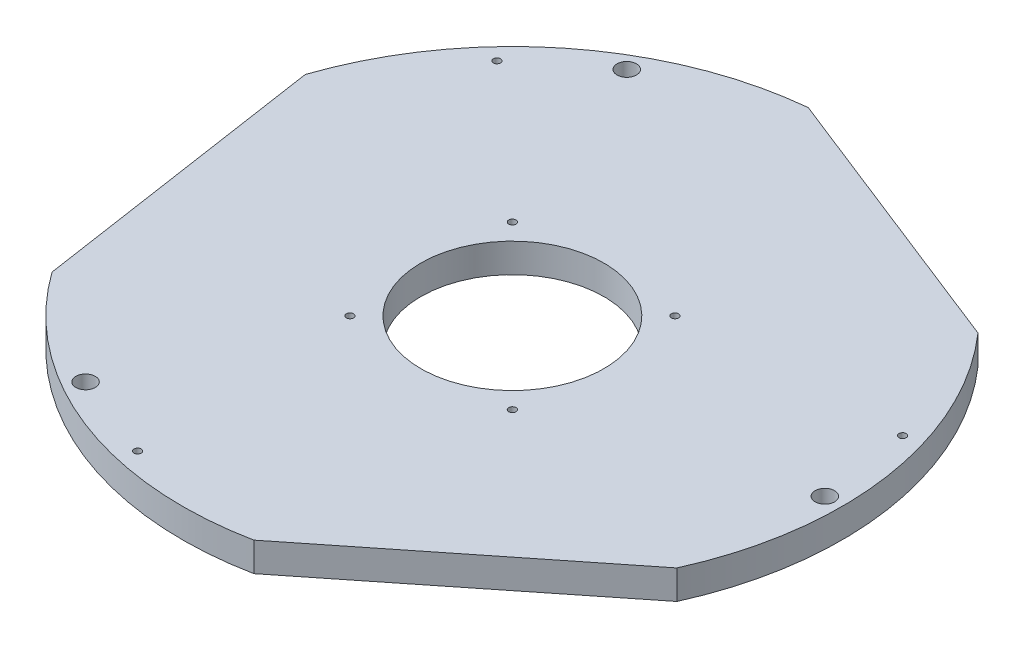
from build123d import *

# Parameters (mm, degrees)
SKETCH1_W                    = 144.145
SKETCH1_H                    = 12.7
F_1_8_0_125_DIAMETER_HOLE1_D = 3.175
SKETCH4_OUTSIDE_W            = 371.87
SKETCH4_OUTSIDE_H            = 371.87
CUT_EXTRUDE1_DEPTH           = 205.247036821
SKETCH6_R                    = 40
CUT_EXTRUDE2_DEPTH           = 205.247036821
M10X1_5_TAPPED_HOLE1_D       = 8.5


with BuildPart() as part:
    # Sketch1 → Revolve1 (revolve)
    with BuildSketch(Plane.XY):
        with Locations((72.0725, -28.730222222)):
            Rectangle(SKETCH1_W, SKETCH1_H)
    revolve(axis=Axis((1e-09, -200000, 0), (0, 1, 0)))

    # 1/8 (0.125) Diameter Hole1 (through all)
    with Locations(Plane(origin=(0, -22.380222222, 0), x_dir=(1, 0, 0), z_dir=(0, 1, 0))):
        with Locations((136.525, 0), (-68.2625, -118.234118252), (-68.2625, 118.234118252), (-99.848064114, 93.109826108), (130.559506808, 39.916046987), (-30.711442694, -133.025873095), (-35.5, -35.5), (-35.5, 35.5), (35.5, 35.5), (35.5, -35.5)):
            Hole(F_1_8_0_125_DIAMETER_HOLE1_D / 2)

    # Sketch4 outside → Cut-Extrude1 (cut, through all)
    with BuildSketch(Plane(origin=(0, -22.380222222, 0), x_dir=(1, 0, 0), z_dir=(0, 1, 0))):
        Rectangle(SKETCH4_OUTSIDE_W, SKETCH4_OUTSIDE_H)
        Polygon((253.722129587, 37.919026331), (-94.022224704, -238.68932289), (-159.699904883, 200.770296559), align=None, mode=Mode.SUBTRACT)
    extrude(amount=-CUT_EXTRUDE1_DEPTH, mode=Mode.SUBTRACT)

    # Sketch6 → Cut-Extrude2 (cut, through all)
    with BuildSketch(Plane(origin=(0, -22.380222222, 0), x_dir=(1, 0, 0), z_dir=(0, 1, 0))):
        with Locations(Location((0, 0, 0), (0, 0, 180))):
            Circle(SKETCH6_R)
    extrude(amount=-CUT_EXTRUDE2_DEPTH, mode=Mode.SUBTRACT)

    # M10x1.5 Tapped Hole1 (through all)
    with Locations(Plane(origin=(0, -22.380222222, 0), x_dir=(1, 0, 0), z_dir=(0, 1, 0))):
        with Locations((-68.2625, 118.234118252), (136.525, 0), (-68.2625, -118.234118252)):
            Hole(M10X1_5_TAPPED_HOLE1_D / 2)


solid = part.part
